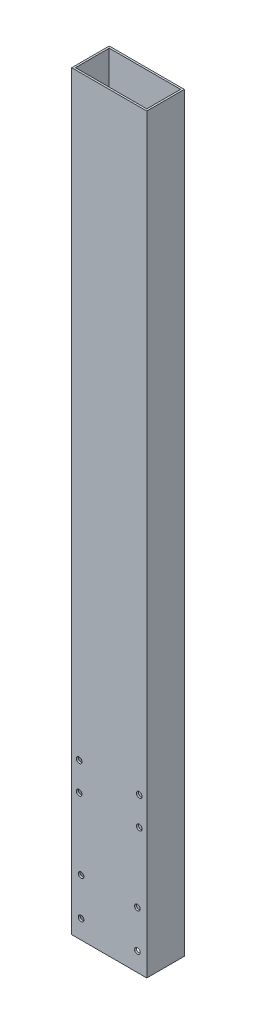
from build123d import *

# Parameters (mm, degrees)
SKETCH_12_W                   = 40
SKETCH_12_H                   = 20
SKETCH_12_W_2                 = 38
SKETCH_12_H_2                 = 18
F_20X40X1_LVGUAN20X40_1_DEPTH = 450
SKETCH_13_R                   = 1.5
CUT_EXTRUDE_1_DEPTH           = 51
SKETCH_14_W                   = 50.928856462
SKETCH_14_H                   = 27.036577468
CUT_EXTRUDE_2_DEPTH           = 50


with BuildPart() as part:
    # 草图12 → 20x40x1 LVGUAN20X40(1) (new body)
    with BuildSketch(Plane.XZ):
        Rectangle(SKETCH_12_W, SKETCH_12_H)
        Rectangle(SKETCH_12_W_2, SKETCH_12_H_2, mode=Mode.SUBTRACT)
    extrude(amount=F_20X40X1_LVGUAN20X40_1_DEPTH)

    # 草图13 → 切除-拉伸1 (cut)
    with BuildSketch(Plane.XY.offset(10)):
        with Locations((16, -382.5)):
            Circle(SKETCH_13_R)
        with Locations((16, -367.5)):
            Circle(SKETCH_13_R)
        with Locations((-16, -367.5)):
            Circle(SKETCH_13_R)
        with Locations((-16, -382.5)):
            Circle(SKETCH_13_R)
        with Locations((15, -420)):
            Circle(SKETCH_13_R)
        with Locations((-15, -420)):
            Circle(SKETCH_13_R)
        with Locations((-15, -440)):
            Circle(SKETCH_13_R)
        with Locations((15, -440)):
            Circle(SKETCH_13_R)
    extrude(amount=-CUT_EXTRUDE_1_DEPTH, mode=Mode.SUBTRACT)

    # 草图14 → 切除-拉伸2 (cut)
    with BuildSketch(Plane(origin=(0, 0, 0), x_dir=(1, 0, 0), z_dir=(0, 1, 0))):
        Rectangle(SKETCH_14_W, SKETCH_14_H)
    extrude(amount=-CUT_EXTRUDE_2_DEPTH, mode=Mode.SUBTRACT)


solid = part.part
